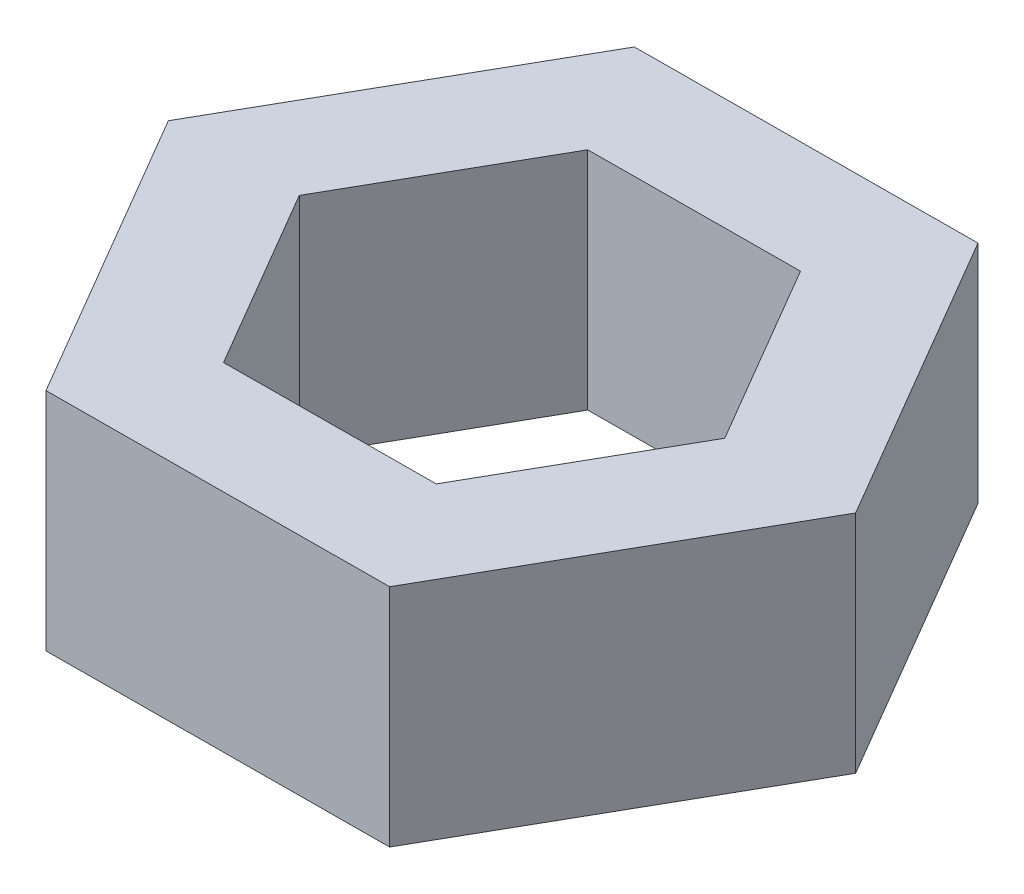
from build123d import *

# Parameters (mm, degrees)
SALIENTE_EXTRUIR1_DEPTH = 8


with BuildPart() as part:
    # Croquis1 → Saliente-Extruir1 (new body)
    with BuildSketch(Plane(origin=(0, 0, 0), x_dir=(1, 0, 0), z_dir=(0, 1, 0))):
        Polygon((12.124151894, 0.070291154), (6.001202022, 10.534969117), (-6.122949872, 10.464677963), (-12.124151894, -0.070291154), (-6.001202022, -10.534969117), (6.122949872, -10.464677963), align=None)
        Polygon((3.79039754, -6.478133977), (7.505427363, 0.043513571), (3.715029823, 6.521647548), (-3.79039754, 6.478133977), (-7.505427363, -0.043513571), (-3.715029823, -6.521647548), align=None, mode=Mode.SUBTRACT)
    extrude(amount=SALIENTE_EXTRUIR1_DEPTH)


solid = part.part
